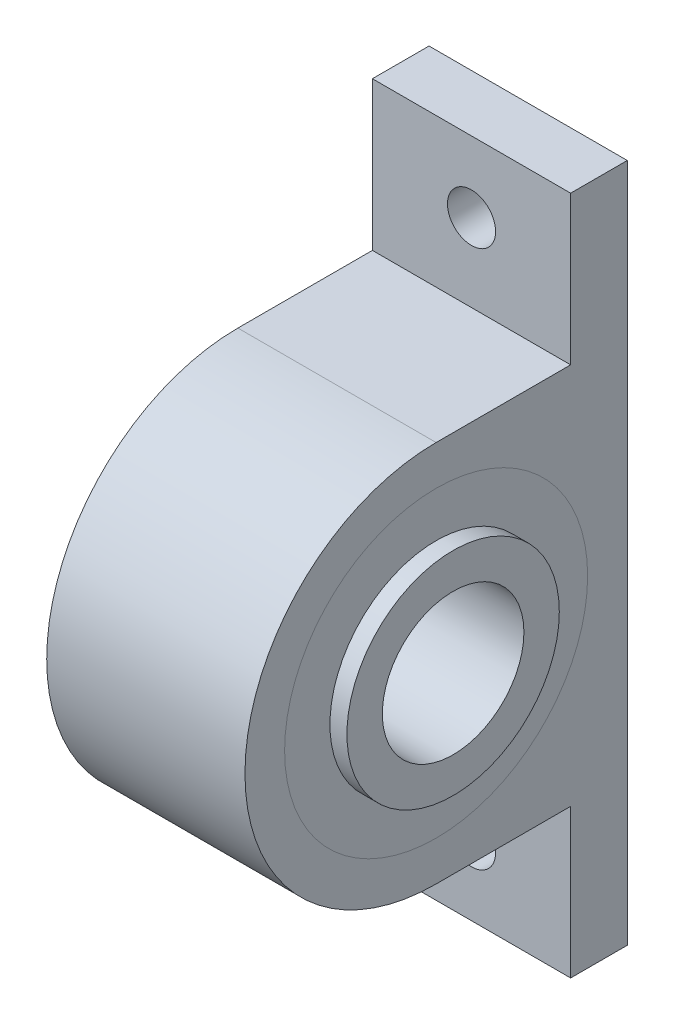
from build123d import *

# Parameters (mm, degrees)
SKETCH1_W                       = 70
SKETCH1_H                       = 240
BOSS_EXTRUDE1_DEPTH             = 20
BOSS_EXTRUDE2_REACH             = 128.59
SKETCH2_R                       = 67.5
BOSS_EXTRUDE2_DIRECTION_2_REACH = 128.59
BOSS_EXTRUDE3_REACH             = 185.984
BOSS_EXTRUDE3_DIRECTION_2_REACH = 185.984
SKETCH4_R                       = 53.5
CUT_EXTRUDE1_DEPTH              = 216
SKETCH5_R                       = 53.5
SKETCH5_R_2                     = 37.5
BOSS_EXTRUDE4_DEPTH             = 70
BOSS_EXTRUDE6_DEPTH             = 41
BOSS_EXTRUDE6_DEPTH_BACK        = 45
SKETCH6_R                       = 37.5
SKETCH6_R_2                     = 25
SKETCH7_R                       = 8.5
CUT_EXTRUDE2_DEPTH              = 58


with BuildPart() as part:
    # Sketch1 → Boss-Extrude1 (new body)
    with BuildSketch(Plane.XY):
        Rectangle(SKETCH1_W, SKETCH1_H)
    extrude(amount=BOSS_EXTRUDE1_DEPTH)

    # Boss-Extrude2: up to this face of the body (flat: up to its plane)
    boss_extrude2_end = Plane(part.part.faces().sort_by_distance((35, 0, 10))[0])
    # Sketch2 → Boss-Extrude2 (add, up to the picked face)
    with BuildSketch(Plane(origin=(0, 0, 0), x_dir=(0, 0, -1), z_dir=(1, 0, 0)), mode=Mode.PRIVATE) as boss_extrude2_sk1:
        with Locations((-67.5, 0)):
            Circle(SKETCH2_R)
    boss_extrude2_tool1 = split(extrude(boss_extrude2_sk1.sketch, amount=BOSS_EXTRUDE2_REACH, mode=Mode.PRIVATE), bisect_by=boss_extrude2_end, keep=Keep.BOTH, mode=Mode.PRIVATE)
    add(boss_extrude2_tool1.solids().sort_by(Axis((0, 0, 67.5), (1, 0, 0)))[0])

    # Boss-Extrude2 direction 2: up to this face of the body (flat: up to its plane)
    boss_extrude2_direction_2_end = Plane(part.part.faces().sort_by_distance((-35, 0, 10))[0])
    # Sketch2 → Boss-Extrude2 direction 2 (add, up to the picked face)
    with BuildSketch(Plane(origin=(0, 0, 0), x_dir=(0, 0, -1), z_dir=(1, 0, 0)), mode=Mode.PRIVATE) as boss_extrude2_direction_2_sk1:
        with Locations((-67.5, 0)):
            Circle(SKETCH2_R)
    boss_extrude2_direction_2_tool1 = split(extrude(boss_extrude2_direction_2_sk1.sketch, amount=-BOSS_EXTRUDE2_DIRECTION_2_REACH, mode=Mode.PRIVATE), bisect_by=boss_extrude2_direction_2_end, keep=Keep.BOTH, mode=Mode.PRIVATE)
    add(boss_extrude2_direction_2_tool1.solids().sort_by(Axis((0, 0, 67.5), (-1, 0, 0)))[0])

    # Boss-Extrude3: up to this face of the body (flat: up to its plane)
    boss_extrude3_end = Plane(part.part.faces().sort_by_distance((35, 0, 56.120224161))[0])
    # Sketch3 → Boss-Extrude3 (add, up to the picked face)
    with BuildSketch(Plane(origin=(0, 0, 0), x_dir=(0, 0, -1), z_dir=(1, 0, 0)), mode=Mode.PRIVATE) as boss_extrude3_sk1:
        with BuildLine():
            ThreePointArc((-20, -47.958315233), (-41.818647604, -62.423698538), (-67.5, -67.5))
            Line((-67.5, -67.5), (-20, -67.5))
            Line((-20, -67.5), (-20, -47.958315233))
        make_face()
    boss_extrude3_tool1 = split(extrude(boss_extrude3_sk1.sketch, amount=BOSS_EXTRUDE3_REACH, mode=Mode.PRIVATE), bisect_by=boss_extrude3_end, keep=Keep.BOTH, mode=Mode.PRIVATE)
    # Sketch3 → Boss-Extrude3 (add, up to the picked face)
    with BuildSketch(Plane(origin=(0, 0, 0), x_dir=(0, 0, -1), z_dir=(1, 0, 0)), mode=Mode.PRIVATE) as boss_extrude3_sk2:
        with BuildLine():
            ThreePointArc((-67.5, 67.5), (-41.818647604, 62.423698538), (-20, 47.958315233))
            Line((-20, 47.958315233), (-20, 67.5))
            Line((-20, 67.5), (-67.5, 67.5))
        make_face()
    boss_extrude3_tool2 = split(extrude(boss_extrude3_sk2.sketch, amount=BOSS_EXTRUDE3_REACH, mode=Mode.PRIVATE), bisect_by=boss_extrude3_end, keep=Keep.BOTH, mode=Mode.PRIVATE)
    add(boss_extrude3_tool1.solids().sort_by(Axis((0, -61.818458, 31.503722), (1, 0, 0)))[0])
    add(boss_extrude3_tool2.solids().sort_by(Axis((0, 61.818458, 31.503722), (1, 0, 0)))[0])

    # Boss-Extrude3 direction 2: up to this face of the body (flat: up to its plane)
    boss_extrude3_direction_2_end = Plane(part.part.faces().sort_by_distance((-35, 0, 56.120224161))[0])
    # Sketch3 → Boss-Extrude3 direction 2 (add, up to the picked face)
    with BuildSketch(Plane(origin=(0, 0, 0), x_dir=(0, 0, -1), z_dir=(1, 0, 0)), mode=Mode.PRIVATE) as boss_extrude3_direction_2_sk1:
        with BuildLine():
            ThreePointArc((-20, -47.958315233), (-41.818647604, -62.423698538), (-67.5, -67.5))
            Line((-67.5, -67.5), (-20, -67.5))
            Line((-20, -67.5), (-20, -47.958315233))
        make_face()
    boss_extrude3_direction_2_tool1 = split(extrude(boss_extrude3_direction_2_sk1.sketch, amount=-BOSS_EXTRUDE3_DIRECTION_2_REACH, mode=Mode.PRIVATE), bisect_by=boss_extrude3_direction_2_end, keep=Keep.BOTH, mode=Mode.PRIVATE)
    # Sketch3 → Boss-Extrude3 direction 2 (add, up to the picked face)
    with BuildSketch(Plane(origin=(0, 0, 0), x_dir=(0, 0, -1), z_dir=(1, 0, 0)), mode=Mode.PRIVATE) as boss_extrude3_direction_2_sk2:
        with BuildLine():
            ThreePointArc((-67.5, 67.5), (-41.818647604, 62.423698538), (-20, 47.958315233))
            Line((-20, 47.958315233), (-20, 67.5))
            Line((-20, 67.5), (-67.5, 67.5))
        make_face()
    boss_extrude3_direction_2_tool2 = split(extrude(boss_extrude3_direction_2_sk2.sketch, amount=-BOSS_EXTRUDE3_DIRECTION_2_REACH, mode=Mode.PRIVATE), bisect_by=boss_extrude3_direction_2_end, keep=Keep.BOTH, mode=Mode.PRIVATE)
    add(boss_extrude3_direction_2_tool1.solids().sort_by(Axis((0, -61.818458, 31.503722), (-1, 0, 0)))[0])
    add(boss_extrude3_direction_2_tool2.solids().sort_by(Axis((0, 61.818458, 31.503722), (-1, 0, 0)))[0])

    # Sketch4 → Cut-Extrude1 (cut)
    with BuildSketch(Plane(origin=(35, 0, 0), x_dir=(0, 0, -1), z_dir=(1, 0, 0))):
        with Locations((-67.5, 0)):
            Circle(SKETCH4_R)
    extrude(amount=-CUT_EXTRUDE1_DEPTH, mode=Mode.SUBTRACT)

    # Sketch7 → Cut-Extrude2 (cut)
    with BuildSketch(Plane.XY.offset(20)):
        with Locations((0, -95)):
            Circle(SKETCH7_R)
        with Locations((0, 95)):
            Circle(SKETCH7_R)
    extrude(amount=-CUT_EXTRUDE2_DEPTH, mode=Mode.SUBTRACT)


with BuildPart() as body_2:
    # Sketch5 → Boss-Extrude4 (new body)
    with BuildSketch(Plane(origin=(35, 0, 0), x_dir=(0, 0, -1), z_dir=(1, 0, 0))):
        with Locations((-67.5, 0)):
            Circle(SKETCH5_R)
        with Locations((-67.5, 0)):
            Circle(SKETCH5_R_2, mode=Mode.SUBTRACT)
    extrude(amount=-BOSS_EXTRUDE4_DEPTH)


with BuildPart() as body_3:
    # Sketch6 → Boss-Extrude6 (new, two sides: drawn at the far end of the back side and taken through both)
    with BuildSketch(Plane(origin=(0, 0, 0), x_dir=(0, 0, -1), z_dir=(1, 0, 0)).offset(-BOSS_EXTRUDE6_DEPTH_BACK)):
        with Locations((-67.5, 0)):
            Circle(SKETCH6_R)
        with Locations((-67.5, 0)):
            Circle(SKETCH6_R_2, mode=Mode.SUBTRACT)
    extrude(amount=BOSS_EXTRUDE6_DEPTH + BOSS_EXTRUDE6_DEPTH_BACK)


solid = Compound([part.part, body_2.part, body_3.part])
